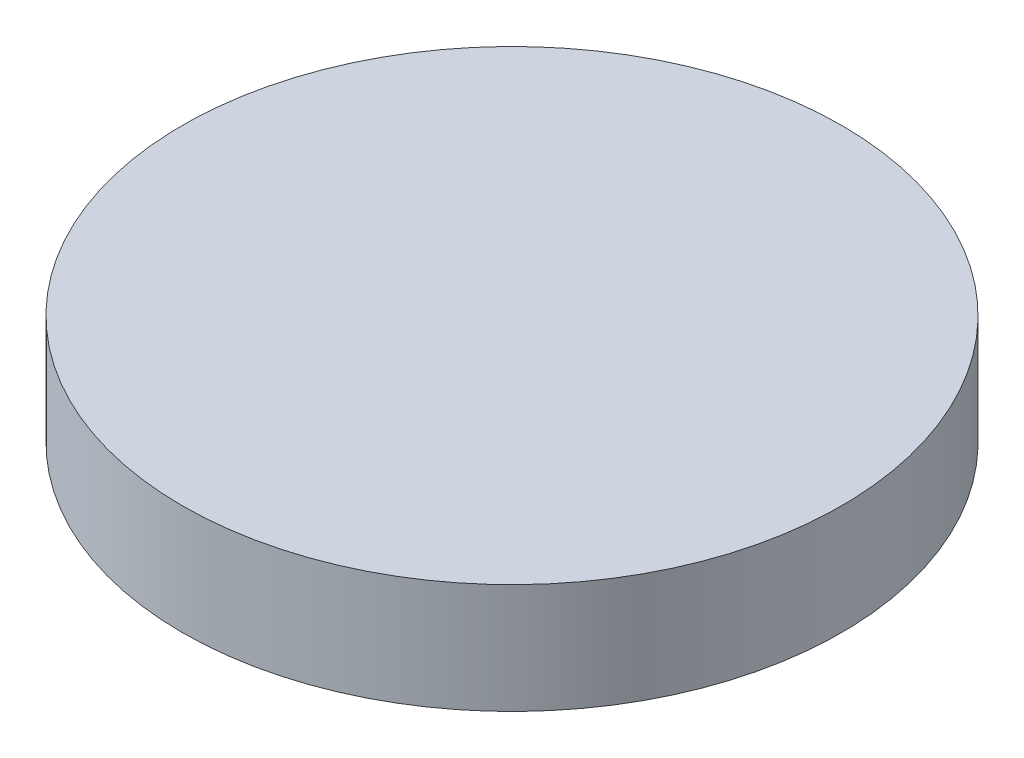
from build123d import *

# Parameters (mm, degrees)
SKETCH1_R           = 6
BOSS_EXTRUDE1_DEPTH = 2


with BuildPart() as part:
    # Sketch1 → Boss-Extrude1 (new body)
    with BuildSketch(Plane(origin=(0, 0, 0), x_dir=(1, 0, 0), z_dir=(0, 1, 0))):
        with Locations(Location((0, 0, 0), (0, 0, 270))):
            Circle(SKETCH1_R)
    extrude(amount=BOSS_EXTRUDE1_DEPTH)


solid = part.part
